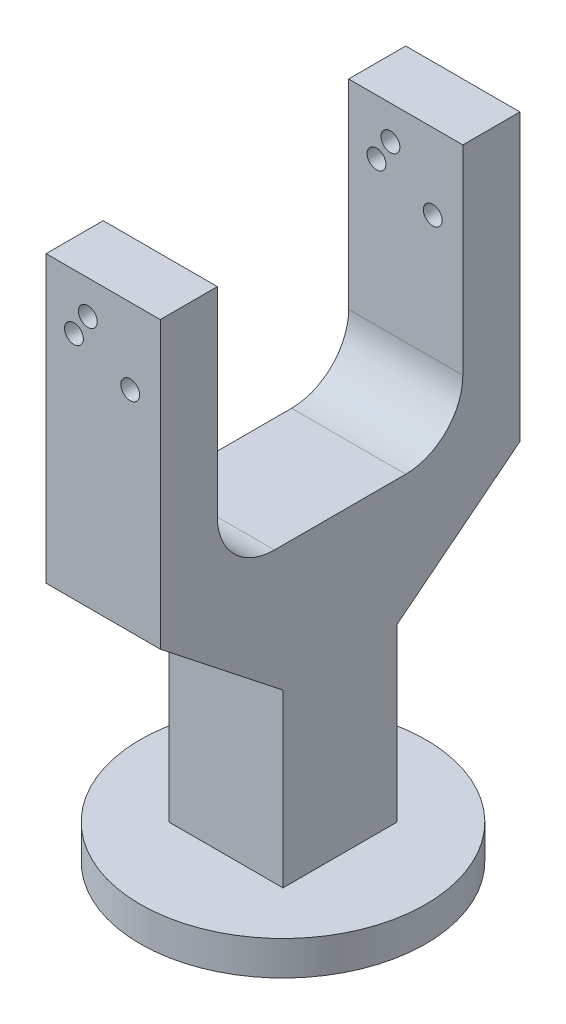
from build123d import *

# Parameters (mm, degrees)
SKETCH1_R           = 25
BOSS_EXTRUDE1_DEPTH = 6
SKETCH2_W           = 20
SKETCH2_H           = 20
BOSS_EXTRUDE2_DEPTH = 30
BOSS_EXTRUDE3_DEPTH = 20
FILLET1_R           = 10
FILLET2_R           = 10
SKETCH4_R           = 11.1
CUT_EXTRUDE1_DEPTH  = 2.2
SKETCH5_R           = 1.65
CUT_EXTRUDE2_DEPTH  = 80


with BuildPart() as part:
    # Sketch1 → Boss-Extrude1 (new body)
    with BuildSketch(Plane(origin=(0, 0, 0), x_dir=(1, 0, 0), z_dir=(0, 1, 0))):
        with Locations(Location((0, 0, 0), (0, 0, 270))):
            Circle(SKETCH1_R)
    extrude(amount=BOSS_EXTRUDE1_DEPTH)

    # Sketch2 → Boss-Extrude2 (add)
    with BuildSketch(Plane(origin=(0, 6, 0), x_dir=(1, 0, 0), z_dir=(0, 1, 0))):
        Rectangle(SKETCH2_W, SKETCH2_H)
    extrude(amount=BOSS_EXTRUDE2_DEPTH)

    # Sketch3 → Boss-Extrude3 (add)
    with BuildSketch(Plane.ZY.offset(10)):
        Polygon((-10, 36), (-31.5, 52.965778424), (-31.5, 102.965778424), (-21.5, 102.965778424), (-21.5, 58.01124712), (21.5, 58.01124712), (21.5, 102.965778424), (31.5, 102.965778424), (31.5, 52.965778424), (10, 36), align=None)
    extrude(amount=-BOSS_EXTRUDE3_DEPTH)

    # Fillet1
    fillet1_edges = [part.edges().sort_by_distance(p)[0] for p in [
        (0, 58.01124712, -21.5),
    ]]
    fillet(fillet1_edges, radius=FILLET1_R)

    # Fillet2
    fillet2_edges = [part.edges().sort_by_distance(p)[0] for p in [
        (0, 58.01124712, 21.5),
    ]]
    fillet(fillet2_edges, radius=FILLET2_R)

    # Sketch4 → Cut-Extrude1 (cut)
    with BuildSketch(Plane.XZ):
        with Locations(Location((0, 0, 0), (0, 0, 270))):
            Circle(SKETCH4_R)
    extrude(amount=-CUT_EXTRUDE1_DEPTH, mode=Mode.SUBTRACT)

    # Sketch5 → Cut-Extrude2 (cut)
    with BuildSketch(Plane.XY.offset(31.5)):
        with Locations((4.734939198, 89.684875187)):
            Circle(SKETCH5_R)
        with Locations((-2.682610937, 97.102425322)):
            Circle(SKETCH5_R)
        with Locations((-5.122436395, 93.272666491)):
            Circle(SKETCH5_R)
    extrude(amount=-CUT_EXTRUDE2_DEPTH, mode=Mode.SUBTRACT)


solid = part.part
